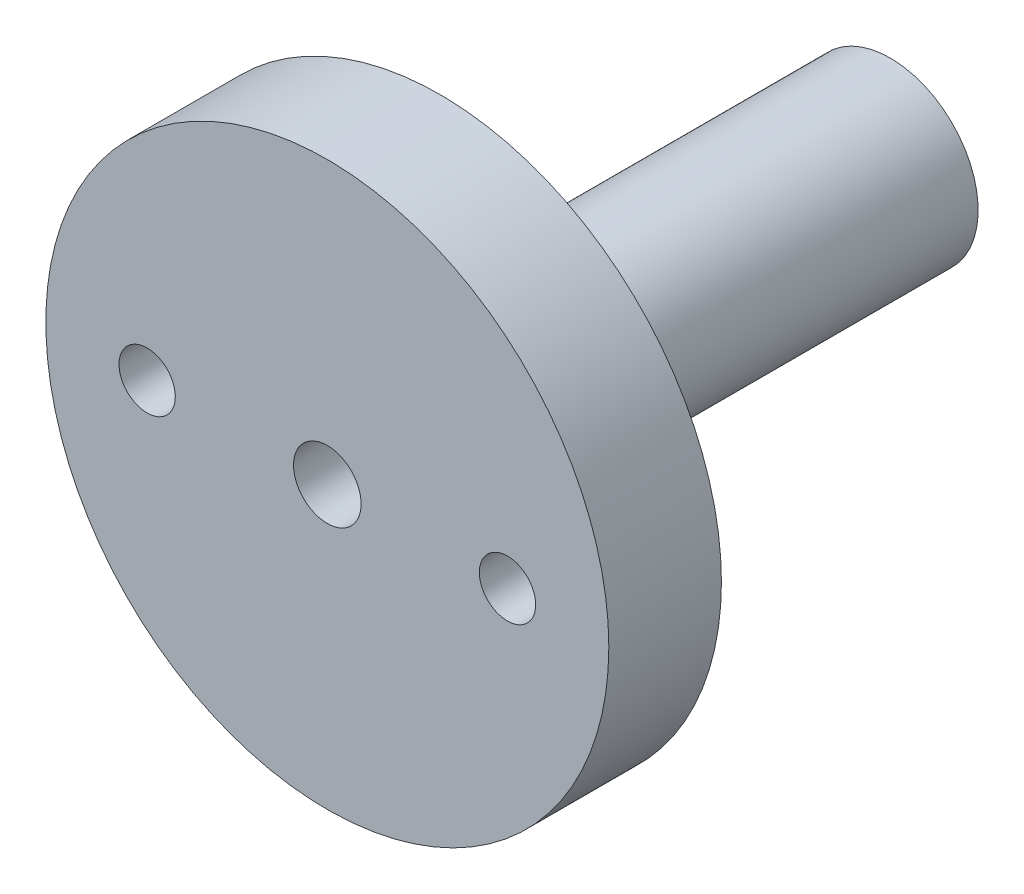
from build123d import *

# Parameters (mm, degrees)
SKETCH1_R           = 12.5
BOSS_EXTRUDE1_DEPTH = 5
SKETCH2_R           = 3.9
BOSS_EXTRUDE2_DEPTH = 20
SKETCH3_R           = 1.5
CUT_EXTRUDE1_DEPTH  = 3
SKETCH4_R           = 1.25
CUT_EXTRUDE2_DEPTH  = 10


with BuildPart() as part:
    # Sketch1 → Boss-Extrude1 (new body)
    with BuildSketch(Plane.XY):
        Circle(SKETCH1_R)
    extrude(amount=BOSS_EXTRUDE1_DEPTH)

    # Sketch2 → Boss-Extrude2 (add)
    with BuildSketch(Plane(origin=(0, 0, 0), x_dir=(-1, 0, 0), z_dir=(0, 0, -1))):
        Circle(SKETCH2_R)
    extrude(amount=BOSS_EXTRUDE2_DEPTH)

    # Sketch3 → Cut-Extrude1 (cut)
    with BuildSketch(Plane.XY.offset(5)):
        Circle(SKETCH3_R)
    extrude(amount=-CUT_EXTRUDE1_DEPTH, mode=Mode.SUBTRACT)

    # Sketch4 → Cut-Extrude2 (cut)
    with BuildSketch(Plane.XY.offset(5)):
        with Locations((8, 0)):
            Circle(SKETCH4_R)
        with Locations((-8, 0)):
            Circle(SKETCH4_R)
    extrude(amount=-CUT_EXTRUDE2_DEPTH, mode=Mode.SUBTRACT)


solid = part.part
